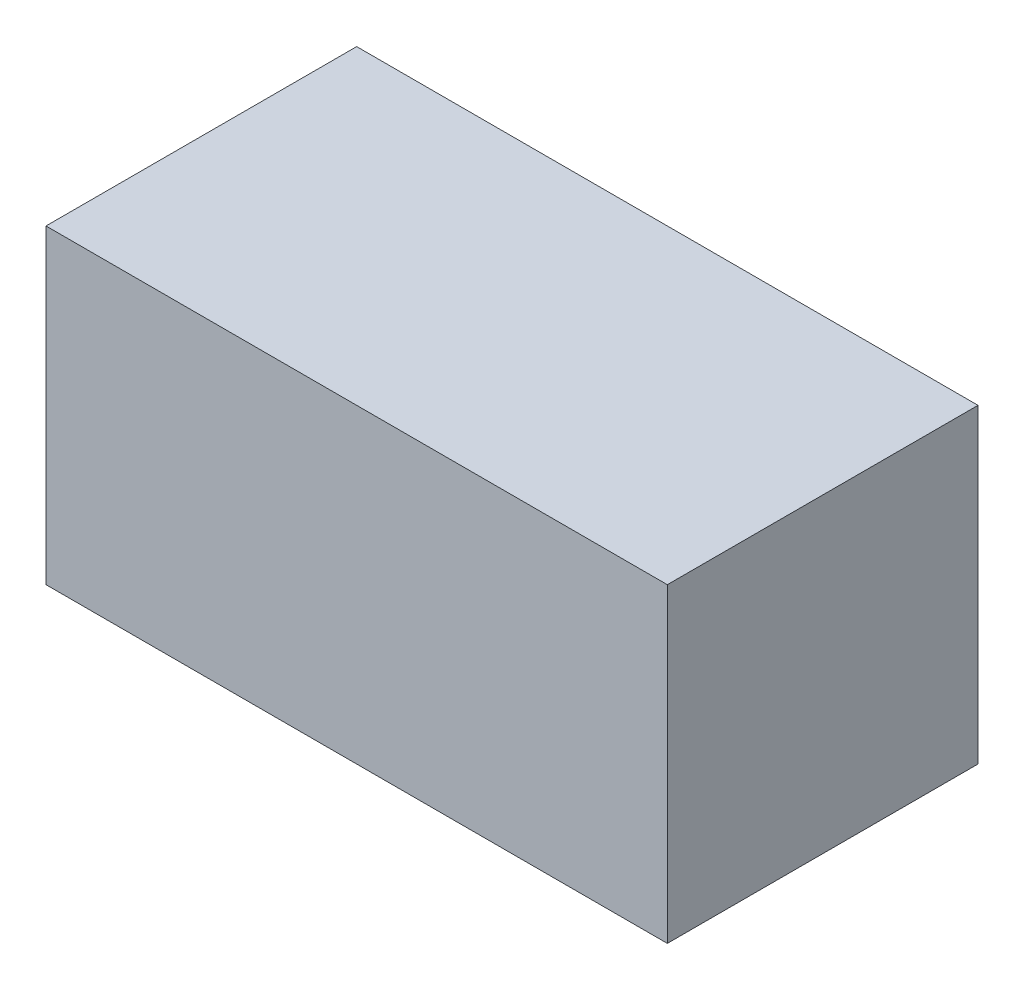
from build123d import *

# Parameters (mm, degrees)
SKETCH1_W           = 101.6
SKETCH1_H           = 50.8
BOSS_EXTRUDE1_DEPTH = 50.8


with BuildPart() as part:
    # Sketch1 → Boss-Extrude1 (new body)
    with BuildSketch(Plane(origin=(0, 0, 0), x_dir=(1, 0, 0), z_dir=(0, 1, 0))):
        Rectangle(SKETCH1_W, SKETCH1_H)
    extrude(amount=-BOSS_EXTRUDE1_DEPTH)


solid = part.part
